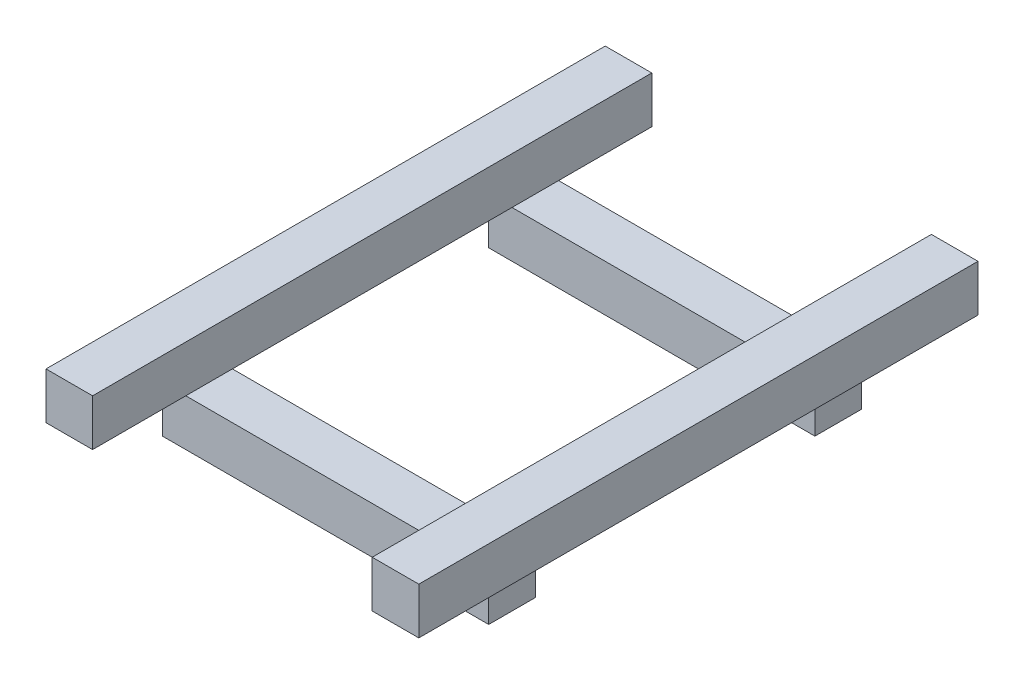
from build123d import *

# Parameters (mm, degrees)
SKETCH1_W             = 50
SKETCH1_H             = 600
BOSS_EXTRUDE1_DEPTH   = 50
BOSS_EXTRUDE1_2_DEPTH = 50
SKETCH2_W             = 400
SKETCH2_H             = 50
BOSS_EXTRUDE2_DEPTH   = 50
SKETCH4_W             = 25
SKETCH4_H             = 400
CUT_EXTRUDE2_DEPTH    = 50


with BuildPart() as part:
    # Sketch1 → Boss-Extrude1 (new body)
    with BuildSketch(Plane(origin=(0, 0, 0), x_dir=(1, 0, 0), z_dir=(0, 1, 0))):
        with Locations((-106.932773109, -129.201680672)):
            Rectangle(SKETCH1_W, SKETCH1_H)
    extrude(amount=BOSS_EXTRUDE1_DEPTH)



with BuildPart() as body_2:
    # Sketch1 → Boss-Extrude1 2 (new body)
    with BuildSketch(Plane(origin=(0, 0, 0), x_dir=(1, 0, 0), z_dir=(0, 1, 0))):
        with Locations((243.067226891, -129.201680672)):
            Rectangle(SKETCH1_W, SKETCH1_H)
    extrude(amount=BOSS_EXTRUDE1_2_DEPTH)


with BuildPart() as part_1:
    add(part.part)

    add(body_2.part)  # Boss-Extrude2 merges body 2
    # Sketch2 → Boss-Extrude2 (add)
    with BuildSketch(Plane(origin=(0, 0, 0), x_dir=(-1, 0, 0), z_dir=(0, -1, 0))):
        with Locations((-68.067226891, -304.201680672)):
            Rectangle(SKETCH2_W, SKETCH2_H)
        with Locations((-68.067226891, 45.798319328)):
            Rectangle(SKETCH2_W, SKETCH2_H)
    extrude(amount=BOSS_EXTRUDE2_DEPTH)

    # Sketch4 → Cut-Extrude2 (cut)
    with BuildSketch(Plane(origin=(0, -50, 0), x_dir=(-1, 0, 0), z_dir=(0, -1, 0))):
        with Locations((-255.567226891, -129.201680672)):
            Rectangle(SKETCH4_W, SKETCH4_H)
        with Locations((119.432773109, -129.201680672)):
            Rectangle(SKETCH4_W, SKETCH4_H)
    extrude(amount=-CUT_EXTRUDE2_DEPTH, mode=Mode.SUBTRACT)


solid = part_1.part
